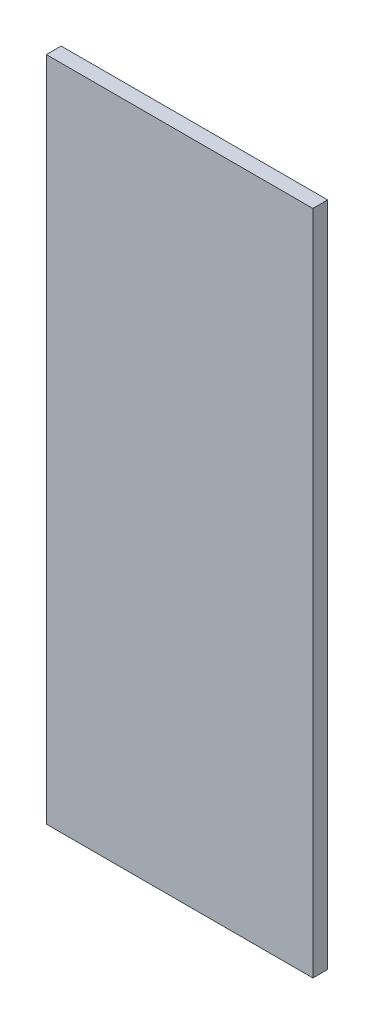
from build123d import *

# Parameters (mm, degrees)
SKETCH1_W           = 114.3
SKETCH1_H           = 285.749
BOSS_EXTRUDE1_DEPTH = 6.35


with BuildPart() as part:
    # Sketch1 → Boss-Extrude1 (new body)
    with BuildSketch(Plane.XY):
        Rectangle(SKETCH1_W, SKETCH1_H)
    extrude(amount=BOSS_EXTRUDE1_DEPTH)


solid = part.part
